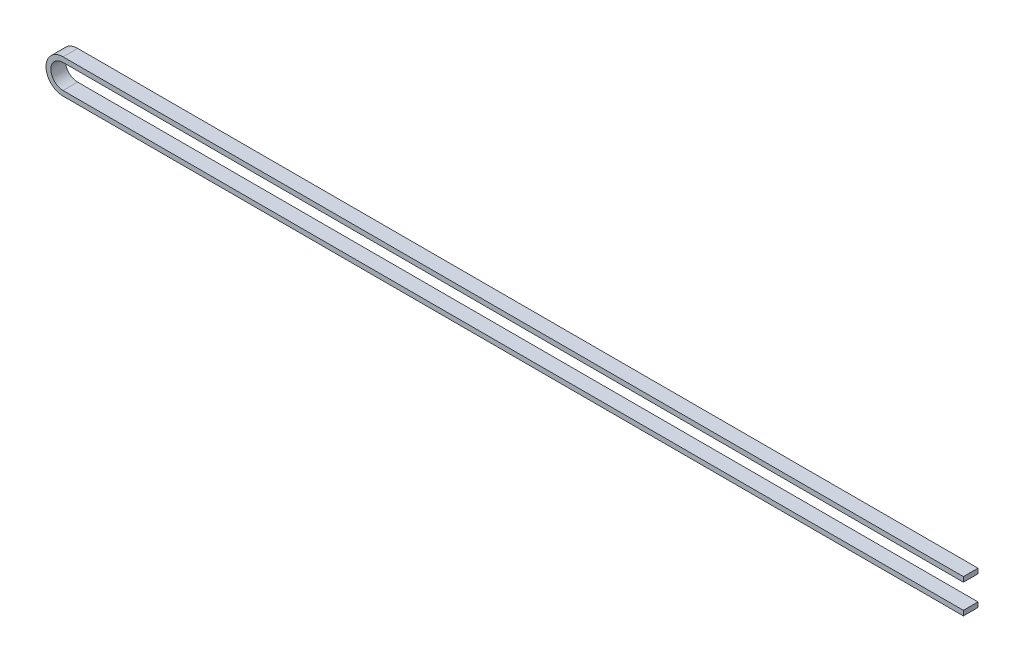
from build123d import *

# Parameters (mm, degrees)
SKETCH_1_W      = 370
SKETCH_1_H      = 6
EXTRUDE_1_DEPTH = 2
SKETCH_2_W      = 370
SKETCH_2_H      = 2
EXTRUDE_2_DEPTH = 6


with BuildPart() as part:
    # Эскиз1 → Бобышка-Вытянуть1 (new body)
    with BuildSketch(Plane(origin=(0, 0, 0), x_dir=(1, 0, 0), z_dir=(0, 1, 0))):
        with Locations((185, 3)):
            Rectangle(SKETCH_1_W, SKETCH_1_H)
    extrude(amount=EXTRUDE_1_DEPTH)

    # Эскиз2 → Бобышка-Вытянуть2 (add)
    with BuildSketch(Plane.XY):
        with BuildLine():
            ThreePointArc((0, 2), (-5, 7), (0, 12))
            Line((0, 12), (0, 14))
            ThreePointArc((0, 14), (-7, 7), (0, 0))
            Line((0, 0), (0, 2))
        make_face()
        with Locations((185, 13)):
            Rectangle(SKETCH_2_W, SKETCH_2_H)
    extrude(amount=-EXTRUDE_2_DEPTH)


solid = part.part
